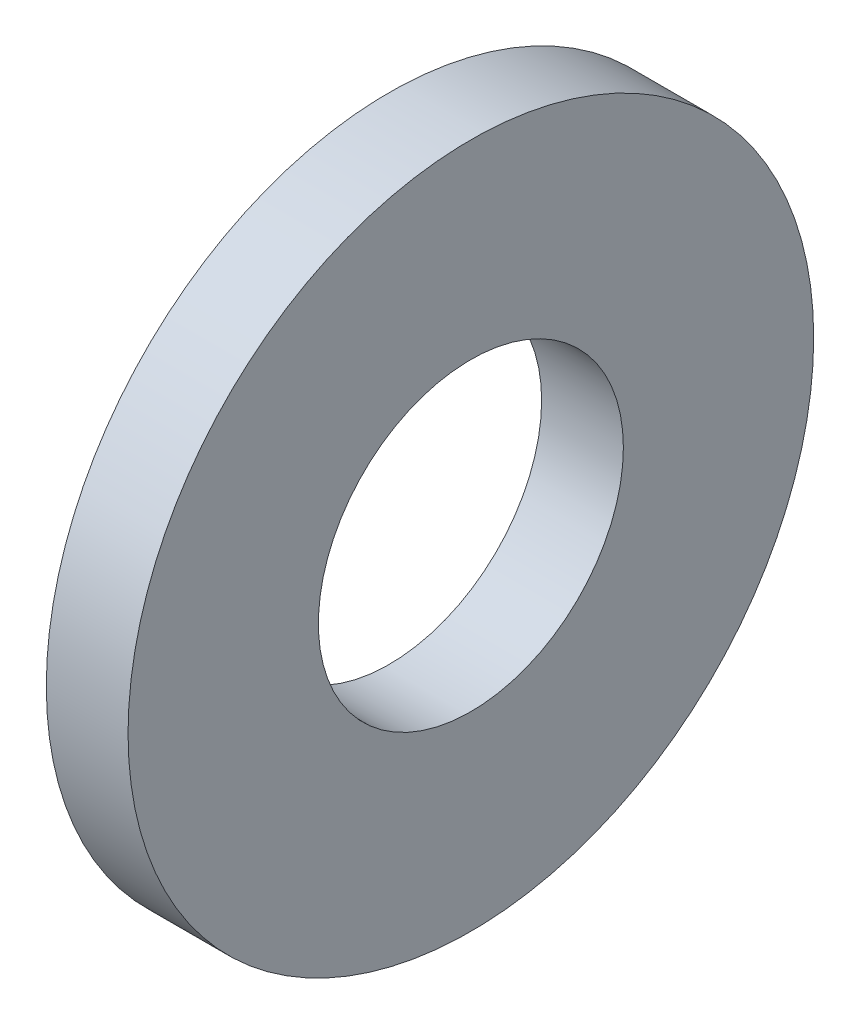
from build123d import *

# Parameters (mm, degrees)
SKETCH1_R           = 7.1374
SKETCH1_R_2         = 3.175
BOSS_EXTRUDE1_DEPTH = 1.7018


with BuildPart() as part:
    # Sketch1 → Boss-Extrude1 (new body)
    with BuildSketch(Plane(origin=(0, 0, 0), x_dir=(0, 0, -1), z_dir=(1, 0, 0))):
        Circle(SKETCH1_R)
        Circle(SKETCH1_R_2, mode=Mode.SUBTRACT)
    extrude(amount=BOSS_EXTRUDE1_DEPTH)


solid = part.part
